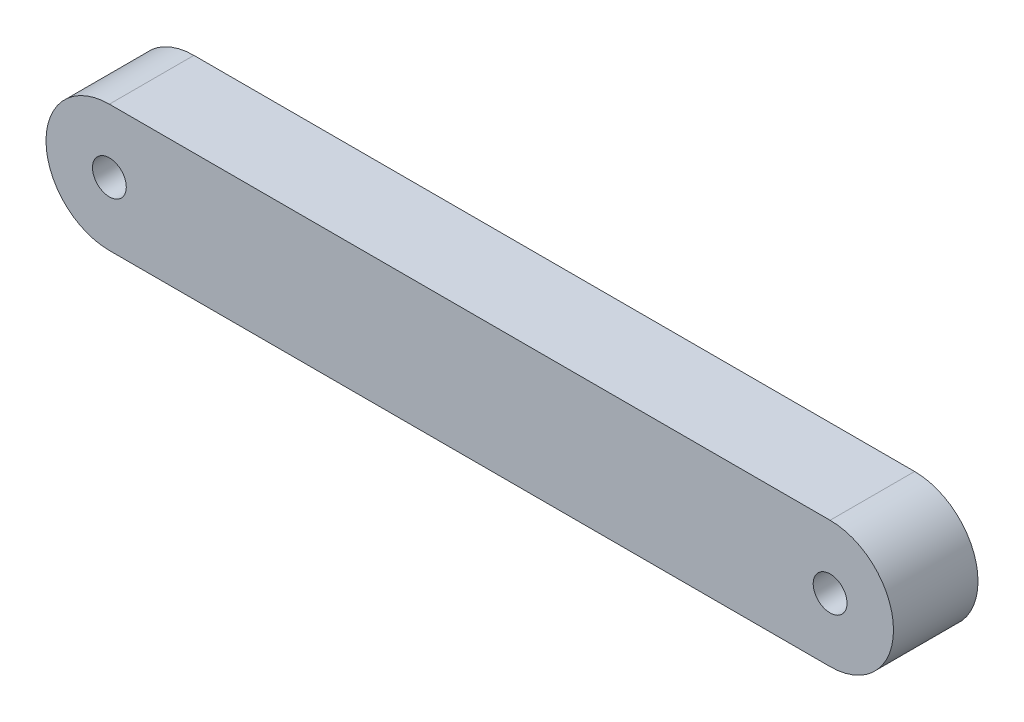
from build123d import *

# Parameters (mm, degrees)
SKETCH_1_R      = 4
EXTRUDE_1_DEPTH = 20


with BuildPart() as part:
    # 草图1 → 凸台-拉伸1 (new body)
    with BuildSketch(Plane.XY):
        with BuildLine():
            Line((0, 15), (170.56, 15))
            ThreePointArc((170.56, 15), (185.56, 0), (170.56, -15))
            Line((170.56, -15), (0, -15))
            ThreePointArc((0, -15), (-15, 0), (0, 15))
        make_face()
        Circle(SKETCH_1_R, mode=Mode.SUBTRACT)
        with Locations((170.56, 0)):
            Circle(SKETCH_1_R, mode=Mode.SUBTRACT)
    extrude(amount=EXTRUDE_1_DEPTH)


solid = part.part
